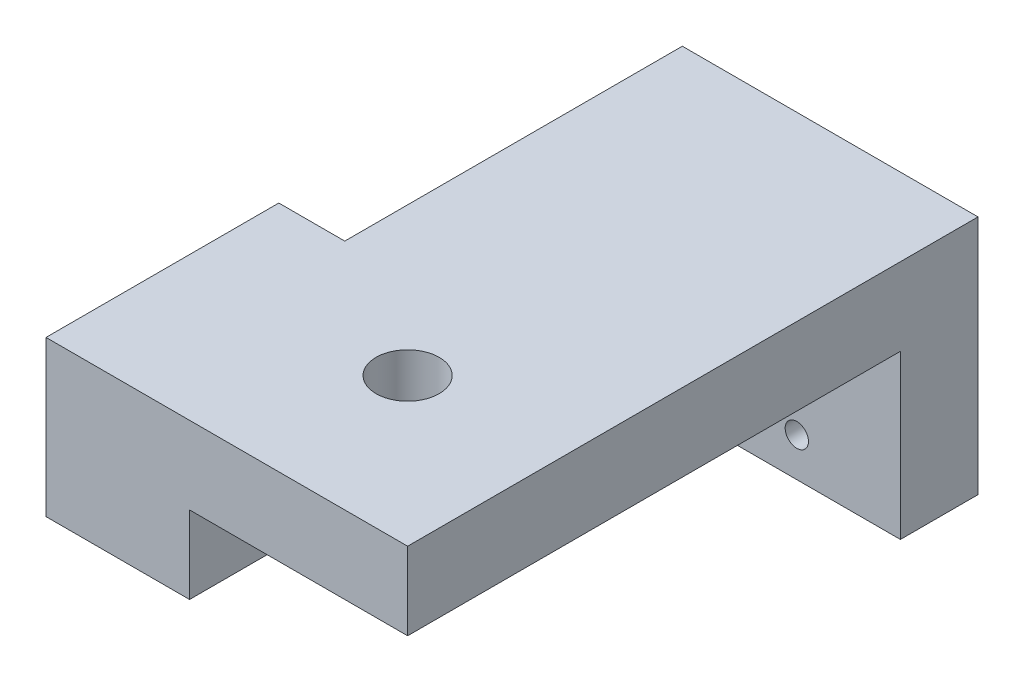
from build123d import *

# Parameters (mm, degrees)
SKETCH1_W                = 38.1
SKETCH1_H                = 63.5
SKETCH1_R                = 4.064
BOSS_EXTRUDE1_DEPTH      = 10
BOSS_EXTRUDE2_DEPTH      = 10
BOSS_EXTRUDE2_DEPTH_BACK = 8.5
SKETCH2_R                = 1.5
SKETCH3_R                = 1.5
BOSS_EXTRUDE3_DEPTH      = 10
SKETCH2_2_R              = 1.5
CUT_EXTRUDE1_DEPTH       = 10
CUT_EXTRUDE2_START       = 10
SKETCH3_2_R              = 1.5
CUT_EXTRUDE2_DEPTH       = 10


with BuildPart() as part:
    # Sketch1 → Boss-Extrude1 (new body)
    with BuildSketch(Plane(origin=(0, 0, 0), x_dir=(1, 0, 0), z_dir=(0, 1, 0))):
        with Locations((19.05, -31.75)):
            Rectangle(SKETCH1_W, SKETCH1_H)
        with Locations((19.05, -44.45)):
            Circle(SKETCH1_R, mode=Mode.SUBTRACT)
    extrude(amount=BOSS_EXTRUDE1_DEPTH)

    # Sketch2 → Boss-Extrude2 (add, two sides: drawn at the far end of the back side and taken through both)
    with BuildSketch(Plane(origin=(0, 0, 0), x_dir=(0, 0, -1), z_dir=(1, 0, 0)).offset(-BOSS_EXTRUDE2_DEPTH_BACK)):
        Polygon((-33.5, 0), (-33.5, -10), (-63.5, -10), (-63.5, 0), (-63.5, 10), (-33.5, 10), align=None)
        with Locations((-59.6, 8)):
            Circle(SKETCH2_R, mode=Mode.SUBTRACT)
        with Locations((-37.4, -2.3)):
            Circle(SKETCH2_R, mode=Mode.SUBTRACT)
    extrude(amount=BOSS_EXTRUDE2_DEPTH + BOSS_EXTRUDE2_DEPTH_BACK)

    # Sketch3 → Boss-Extrude3 (add)
    with BuildSketch(Plane.XY):
        Polygon((13.25, -21), (13.25, -3), (16.25, -3), (16.25, -21), (38.1, -21), (38.1, 10), (0, 10), (0, -21), align=None)
        with Locations((4.75, -16)):
            Circle(SKETCH3_R, mode=Mode.SUBTRACT)
        with Locations((24.75, -16)):
            Circle(SKETCH3_R, mode=Mode.SUBTRACT)
        with Locations((4.75, 4)):
            Circle(SKETCH3_R, mode=Mode.SUBTRACT)
        with Locations((24.75, 4)):
            Circle(SKETCH3_R, mode=Mode.SUBTRACT)
    extrude(amount=-BOSS_EXTRUDE3_DEPTH)

    # Sketch2<2> → Cut-Extrude1 (cut)
    with BuildSketch(Plane(origin=(0, 0, 0), x_dir=(0, 0, -1), z_dir=(1, 0, 0))):
        with Locations((-59.6, 8)):
            Circle(SKETCH2_2_R)
    extrude(amount=CUT_EXTRUDE1_DEPTH, mode=Mode.SUBTRACT)

    # Sketch3<2> → Cut-Extrude2 (cut)
    with BuildSketch(Plane.XY.offset(CUT_EXTRUDE2_START)):
        with Locations((4.75, 4)):
            Circle(SKETCH3_2_R)
        with Locations((24.75, 4)):
            Circle(SKETCH3_2_R)
    extrude(amount=-CUT_EXTRUDE2_DEPTH, mode=Mode.SUBTRACT)


solid = part.part
